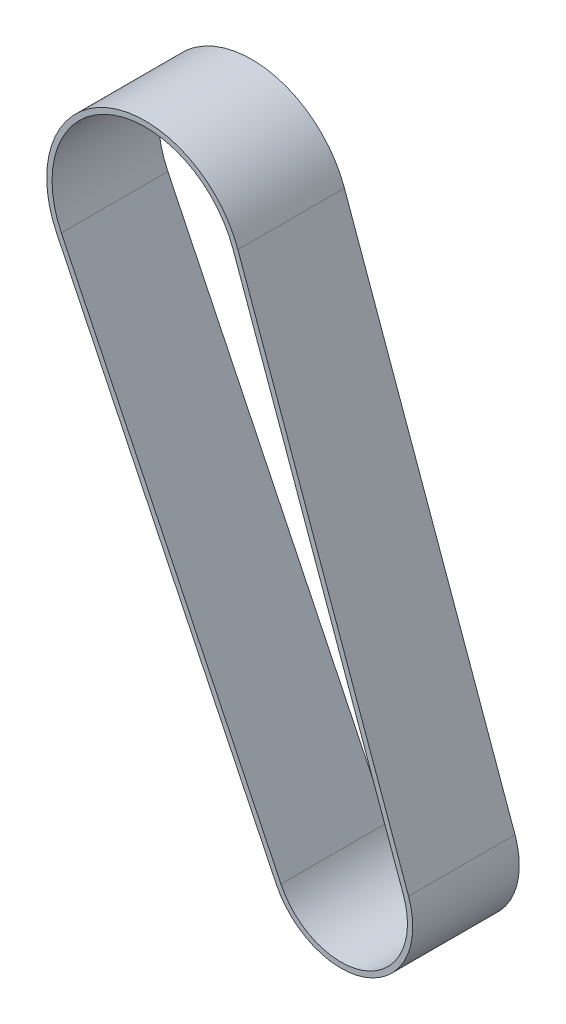
from build123d import *

# Parameters (mm, degrees)
EXTRUDE_1_DEPTH = 20


with BuildPart() as part:
    # Эскиз1 → Вытянуть-Тонкостенный1 (new body)
    with BuildSketch(Plane.XY):
        with BuildLine():
            Line((49.455028562, -82.894210594), (17.409475351, 6.257808561))
            ThreePointArc((17.409475351, 6.257808561), (-7.166671033, 17.055463239), (-16.654041894, -8.055612241))
            Line((-16.654041894, -8.055612241), (24.597867329, -93.339139287))
            ThreePointArc((24.597867329, -93.339139287), (41.980549735, -99.906598124), (49.455028562, -82.894210594))
        make_face()
        with BuildLine():
            Line((48.51397584, -83.232470516), (16.46842263, 5.919548639))
            ThreePointArc((16.46842263, 5.919548639), (-6.77928341, 16.133546307), (-15.753823414, -7.620173741))
            Line((-15.753823414, -7.620173741), (25.498085809, -92.903700788))
            ThreePointArc((25.498085809, -92.903700788), (41.593162112, -98.984681192), (48.51397584, -83.232470516))
        make_face(mode=Mode.SUBTRACT)
    extrude(amount=EXTRUDE_1_DEPTH)


solid = part.part
